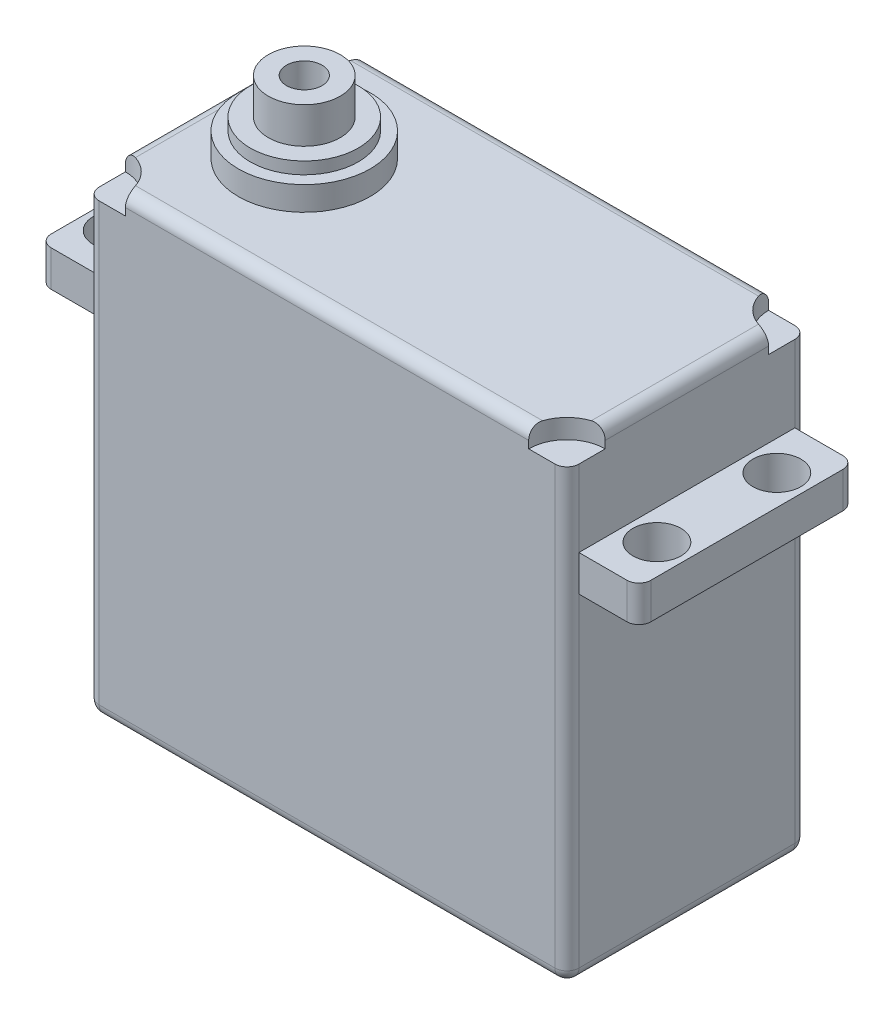
from build123d import *

# Parameters (mm, degrees)
SKETCH_1_W           = 40
SKETCH_1_H           = 39
EXTRUDE_1_DEPTH      = 20
SKETCH_2_R           = 3
EXTRUDE_2_DEPTH      = 6
SKETCH_2_5_R         = 5.5
SKETCH_2_5_R_2       = 4.5
EXTRUDE_5_DEPTH      = 2
SKETCH_2_6_R         = 4.5
SKETCH_2_6_R_2       = 3
EXTRUDE_6_DEPTH      = 3
CUT_EXTRUDE_5_DEPTH  = 1.61
CUT_EXTRUDE_6_DEPTH  = 1.61
FILLET_2_R           = 1
FILLET_3_R           = 1
FILLET_5_R           = 1
FILLET_6_R           = 1
FILLET_9_R           = 1
SKETCH_6_R           = 1.481108103
CUT_EXTRUDE_11_DEPTH = 3
SKETCH_7_W           = 18
SKETCH_7_H           = 3
EXTRUDE_10_DEPTH     = 5
SKETCH_14_R          = 2
CUT_EXTRUDE_12_DEPTH = 45.564559955
SKETCH_12_W          = 18
SKETCH_12_H          = 3
EXTRUDE_11_DEPTH     = 5
SKETCH_15_R          = 2
CUT_EXTRUDE_13_DEPTH = 45.564559955
FILLET_10_R          = 1


with BuildPart() as part:
    # 草图1 → 凸台-拉伸1 (new body)
    with BuildSketch(Plane.XY):
        Rectangle(SKETCH_1_W, SKETCH_1_H)
    extrude(amount=EXTRUDE_1_DEPTH)

    # 草图2 → 凸台-拉伸2 (add)
    with BuildSketch(Plane(origin=(0, 19.5, 0), x_dir=(1, 0, 0), z_dir=(0, 1, 0))):
        with Locations((-11.898044795, -10)):
            Circle(SKETCH_2_R)
    extrude(amount=EXTRUDE_2_DEPTH)

    # 草图2<5> → 凸台-拉伸5 (add)
    with BuildSketch(Plane(origin=(0, 19.5, 0), x_dir=(1, 0, 0), z_dir=(0, 1, 0))):
        with Locations((-11.898044795, -10)):
            Circle(SKETCH_2_5_R)
        with Locations((-11.898044795, -10)):
            Circle(SKETCH_2_5_R_2, mode=Mode.SUBTRACT)
    extrude(amount=EXTRUDE_5_DEPTH)

    # 草图2<6> → 凸台-拉伸6 (add)
    with BuildSketch(Plane(origin=(0, 19.5, 0), x_dir=(1, 0, 0), z_dir=(0, 1, 0))):
        with Locations((-11.898044795, -10)):
            Circle(SKETCH_2_6_R)
        with Locations((-11.898044795, -10)):
            Circle(SKETCH_2_6_R_2, mode=Mode.SUBTRACT)
    extrude(amount=EXTRUDE_6_DEPTH)

    # 草图2<8> → 切除-拉伸5 (cut)
    with BuildSketch(Plane(origin=(0, 19.5, 0), x_dir=(1, 0, 0), z_dir=(0, 1, 0))):
        with BuildLine():
            Line((-16.893747566, 0), (-20, 0))
            Line((-20, 0), (-20, -3.106252434))
            ThreePointArc((-20, -3.106252434), (-17.80354784, -2.19645216), (-16.893747566, 0))
        make_face()
    extrude(amount=-CUT_EXTRUDE_5_DEPTH, mode=Mode.SUBTRACT)

    # 草图2<12> → 切除-拉伸6 (cut)
    with BuildSketch(Plane(origin=(0, 19.5, 0), x_dir=(1, 0, 0), z_dir=(0, 1, 0))):
        with BuildLine():
            ThreePointArc((16.81, 0), (17.744329368, -2.255670632), (20, -3.19))
            Line((20, -3.19), (20, 0))
            Line((20, 0), (16.81, 0))
        make_face()
        with BuildLine():
            Line((-20, -16.81), (-20, -20))
            Line((-20, -20), (-16.81, -20))
            ThreePointArc((-16.81, -20), (-17.744329368, -17.744329368), (-20, -16.81))
        make_face()
        with BuildLine():
            Line((16.81, -20), (20, -20))
            Line((20, -20), (20, -16.81))
            ThreePointArc((20, -16.81), (17.744329368, -17.744329368), (16.81, -20))
        make_face()
    extrude(amount=-CUT_EXTRUDE_6_DEPTH, mode=Mode.SUBTRACT)

    # 圆角2
    fillet_2_edges = [part.edges().sort_by_distance(p)[0] for p in [
        (-0.041873783, 19.5, 0),
    ]]
    fillet(fillet_2_edges, radius=FILLET_2_R)

    # 圆角3
    fillet_3_edges = [part.edges().sort_by_distance(p)[0] for p in [
        (20, 19.5, 10),
        (0, 19.5, 20),
        (-20, 19.5, 9.958126217),
    ]]
    fillet(fillet_3_edges, radius=FILLET_3_R)

    # 圆角5
    fillet_5_edges = [part.edges().sort_by_distance(p)[0] for p in [
        (-20, -0.805, 0),
    ]]
    fillet(fillet_5_edges, radius=FILLET_5_R)

    # 圆角6
    fillet_6_edges = [part.edges().sort_by_distance(p)[0] for p in [
        (20, -0.805, 0),
        (20, -0.805, 20),
        (-20, -0.805, 20),
    ]]
    fillet(fillet_6_edges, radius=FILLET_6_R)

    # 圆角9
    fillet_9_edges = [part.edges().sort_by_distance(p)[0] for p in [
        (-20, -19.5, 10),
        (0, -19.5, 0),
        (20, -19.5, 10),
        (0, -19.5, 20),
        (-19.707106781, -19.5, 19.707106781),
        (-19.707106781, -19.5, 0.292893219),
        (19.707106781, -19.5, 0.292893219),
        (19.707106781, -19.5, 19.707106781),
    ]]
    fillet(fillet_9_edges, radius=FILLET_9_R)

    # 草图6 → 切除-拉伸11 (cut)
    with BuildSketch(Plane(origin=(0, 25.5, 0), x_dir=(1, 0, 0), z_dir=(0, 1, 0))):
        with Locations((-11.898044795, -10)):
            Circle(SKETCH_6_R)
    extrude(amount=-CUT_EXTRUDE_11_DEPTH, mode=Mode.SUBTRACT)

    # 草图7 → 凸台-拉伸10 (add)
    with BuildSketch(Plane(origin=(20, 0, 0), x_dir=(0, 0, -1), z_dir=(1, 0, 0))):
        with Locations((-10, 10)):
            Rectangle(SKETCH_7_W, SKETCH_7_H)
    extrude(amount=EXTRUDE_10_DEPTH)

    # 草图14 → 切除-拉伸12 (cut, through all)
    with BuildSketch(Plane(origin=(0, 11.5, 0), x_dir=(1, 0, 0), z_dir=(0, 1, 0))):
        with Locations((22.5, -5)):
            Circle(SKETCH_14_R)
        with Locations((22.5, -15)):
            Circle(SKETCH_14_R)
    extrude(amount=-CUT_EXTRUDE_12_DEPTH, mode=Mode.SUBTRACT)

    # 草图12 → 凸台-拉伸11 (add)
    with BuildSketch(Plane.ZY.offset(20)):
        with Locations((10, 10)):
            Rectangle(SKETCH_12_W, SKETCH_12_H)
    extrude(amount=EXTRUDE_11_DEPTH)

    # 草图15 → 切除-拉伸13 (cut, through all)
    with BuildSketch(Plane(origin=(0, 11.5, 0), x_dir=(1, 0, 0), z_dir=(0, 1, 0))):
        with Locations((-22.5, -5)):
            Circle(SKETCH_15_R)
        with Locations((-22.5, -15)):
            Circle(SKETCH_15_R)
    extrude(amount=-CUT_EXTRUDE_13_DEPTH, mode=Mode.SUBTRACT)

    # 圆角10
    fillet_10_edges = [part.edges().sort_by_distance(p)[0] for p in [
        (-25, 10, 1),
        (-25, 10, 19),
        (25, 10, 19),
        (25, 10, 1),
    ]]
    fillet(fillet_10_edges, radius=FILLET_10_R)


solid = part.part
